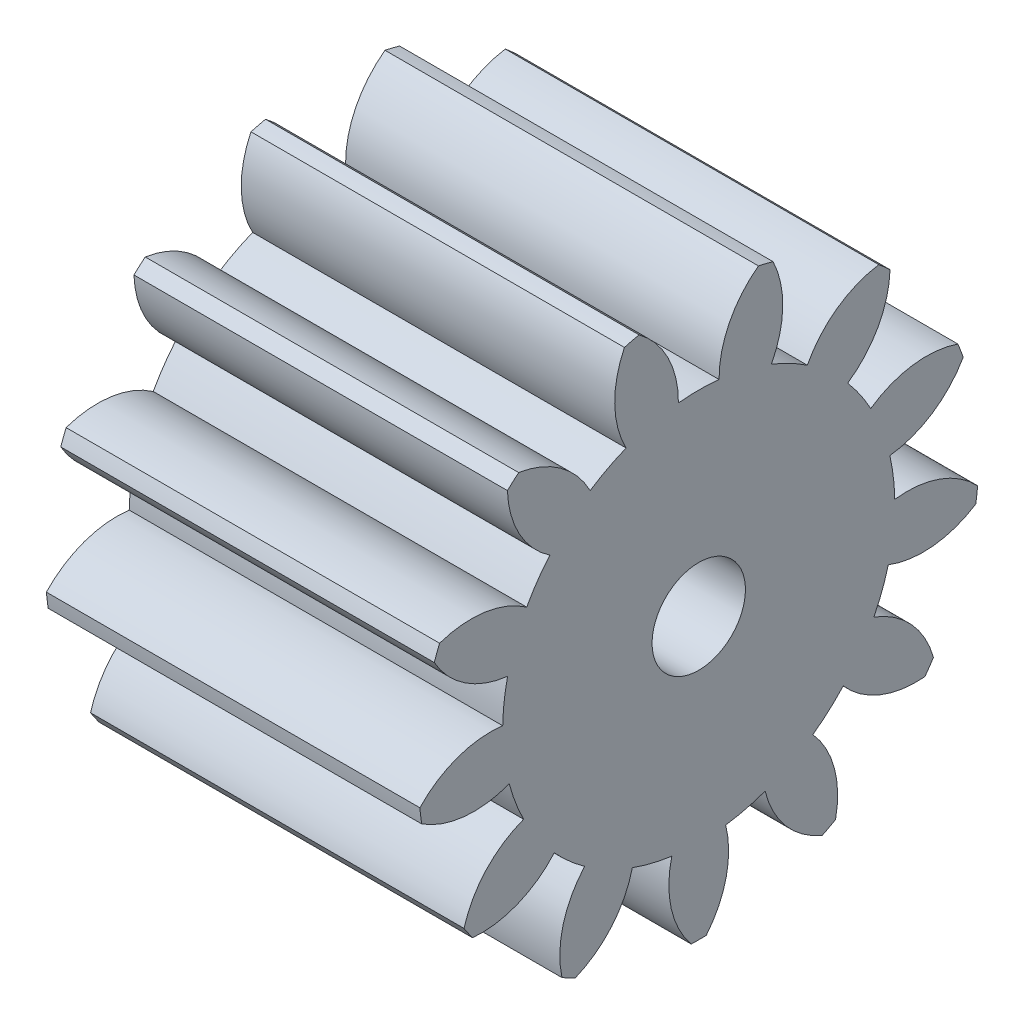
from build123d import *

# Parameters (mm, degrees)
BASPROSKE_W     = 20
BASPROSKE_H     = 15
TOOTHCUT_DEPTH  = 30.154759474
TEETHCUTS_COUNT = 13
TEETHCUTS_ANGLE = 332.307692308
BORSKE_R        = 2.5
BORE_DEPTH      = 50.0000508


with BuildPart() as part:
    # BasProSke → Base-Revolve (revolve)
    with BuildSketch(Plane(origin=(0, 0, 0), x_dir=(1, 0, 0), z_dir=(0, 1, 0)), mode=Mode.PRIVATE) as base_revolve_sk:
        with Locations((10, 7.5)):
            Rectangle(BASPROSKE_W, BASPROSKE_H)
    revolve(base_revolve_sk.sketch.rotate(Axis((-10, 0, 0), (1, 0, 0)), 180), axis=Axis((-10, 0, 0), (1, 0, 0)))

    # TooCutSke → ToothCut (cut, through all)
    with BuildSketch(Plane(origin=(0, 0, 0), x_dir=(0, 0, -1), z_dir=(1, 0, 0))):
        with BuildLine():
            ThreePointArc((1.088245291, 10.442448141), (0, 10.499), (-1.088245291, 10.442448141))
            ThreePointArc((-1.088245291, 10.442448141), (-1.646045958, 12.816546547), (-3.224884568, 14.675243258))
            ThreePointArc((-3.224884568, 14.675243258), (0, 15.0254), (3.224884568, 14.675243258))
            ThreePointArc((3.224884568, 14.675243258), (1.646045958, 12.816546547), (1.088245291, 10.442448141))
        make_face()
    toothcut = extrude(amount=TOOTHCUT_DEPTH, mode=Mode.SUBTRACT)

    # TeethCuts: ToothCut ×13 about axis
    teethcuts_axis = Axis((-10, 0, 0), (1, 0, 0))
    for i in range(1, TEETHCUTS_COUNT):
        add(toothcut.rotate(teethcuts_axis, i * TEETHCUTS_ANGLE / (TEETHCUTS_COUNT - 1)), mode=Mode.SUBTRACT)

    # BorSke → Bore (cut, symmetric)
    with BuildSketch(Plane(origin=(0, 0, 0), x_dir=(0, 0, -1), z_dir=(1, 0, 0))):
        with Locations(Location((0, 0, 0), (0, 0, 180))):
            Circle(BORSKE_R)
    extrude(amount=BORE_DEPTH, both=True, mode=Mode.SUBTRACT)


solid = part.part
